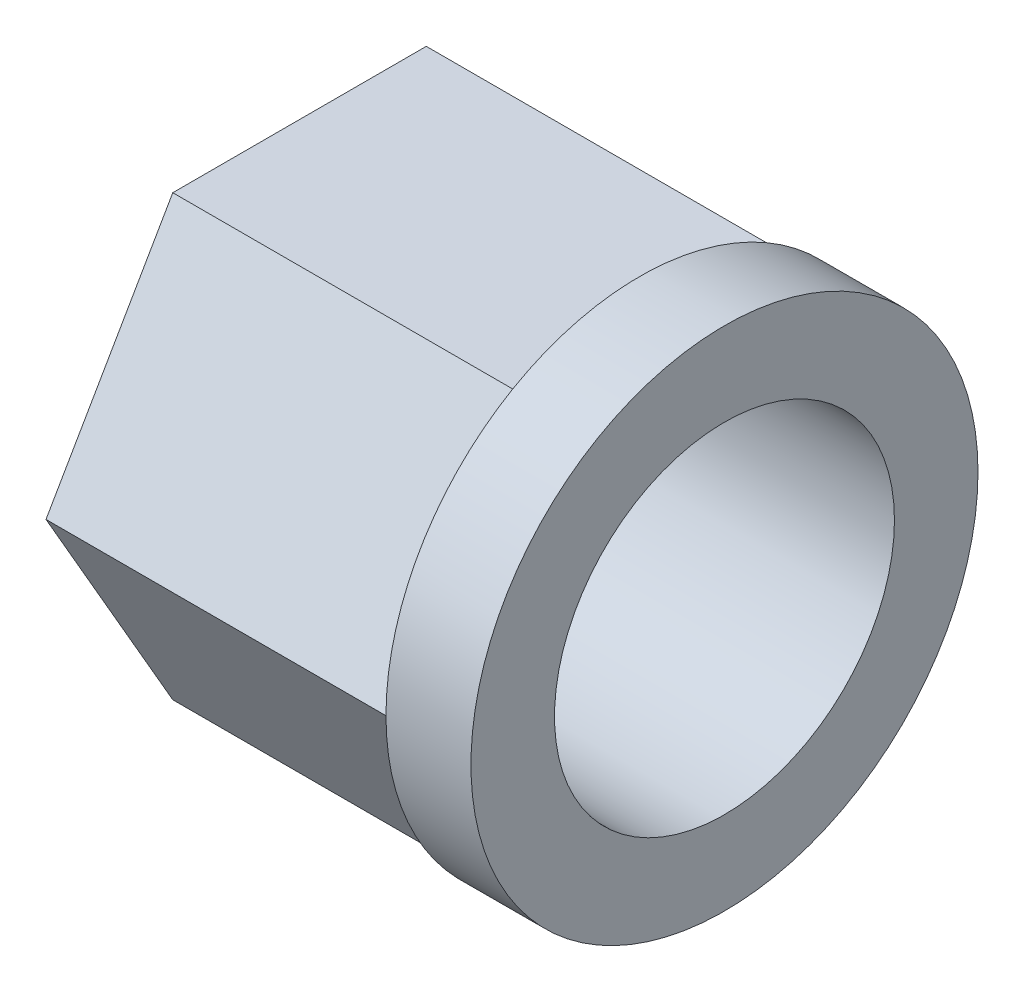
from build123d import *

# Parameters (mm, degrees)
BOSS_EXTRUDE1_DEPTH = 12
SKETCH2_R           = 8.948929172
BOSS_EXTRUDE2_DEPTH = 3
SKETCH3_R           = 3.175
CUT_EXTRUDE1_DEPTH  = 23
SKETCH4_R           = 6
CUT_EXTRUDE2_DEPTH  = 13


with BuildPart() as part:
    # Sketch1 → Boss-Extrude1 (new body)
    with BuildSketch(Plane(origin=(0, 0, 0), x_dir=(0, 0, -1), z_dir=(1, 0, 0))):
        Polygon((8.948929172, 0), (4.474464586, 7.75), (-4.474464586, 7.75), (-8.948929172, 0), (-4.474464586, -7.75), (4.474464586, -7.75), align=None)
    extrude(amount=BOSS_EXTRUDE1_DEPTH)

    # Sketch2 → Boss-Extrude2 (add)
    with BuildSketch(Plane(origin=(12, 0, 0), x_dir=(0, 0, -1), z_dir=(1, 0, 0))):
        Circle(SKETCH2_R)
    extrude(amount=BOSS_EXTRUDE2_DEPTH)

    # Sketch3 → Cut-Extrude1 (cut)
    with BuildSketch(Plane(origin=(15, 0, 0), x_dir=(0, 0, -1), z_dir=(1, 0, 0))):
        Circle(SKETCH3_R)
    extrude(amount=-CUT_EXTRUDE1_DEPTH, mode=Mode.SUBTRACT)

    # Sketch4 → Cut-Extrude2 (cut)
    with BuildSketch(Plane(origin=(15, 0, 0), x_dir=(0, 0, -1), z_dir=(1, 0, 0))):
        Circle(SKETCH4_R)
    extrude(amount=-CUT_EXTRUDE2_DEPTH, mode=Mode.SUBTRACT)


solid = part.part
